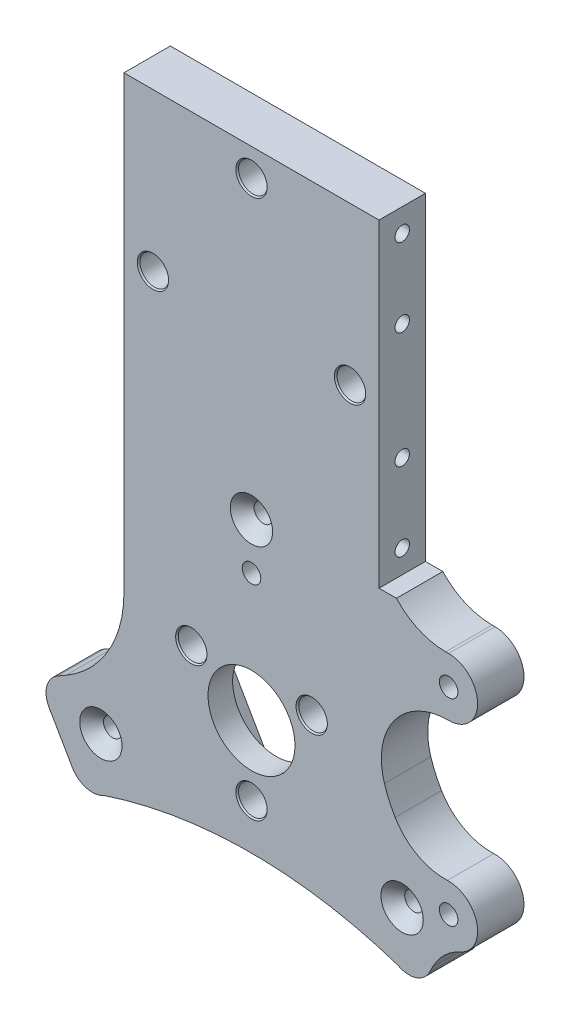
from build123d import *

# Parameters (mm, degrees)
BOSS_EXTRUDE1_DEPTH                             = 8
BOSS_EXTRUDE2_START                             = 3.75
SKETCH1_3_R                                     = 7.5
BOSS_EXTRUDE2_DEPTH                             = 4.25
SKETCH15_W                                      = 44
SKETCH15_H                                      = 8
BOSS_EXTRUDE3_DEPTH                             = 36
SKETCH22_W                                      = 5
SKETCH22_H                                      = 10
CUT_EXTRUDE1_DEPTH                              = 10
CSK_FOR_M3_FLAT_HEAD_MACHINE_SCREW1_D           = 3.2
CSK_FOR_M3_FLAT_HEAD_MACHINE_SCREW1_CSINK_D     = 7.3
CSK_FOR_M3_FLAT_HEAD_MACHINE_SCREW1_CSINK_ANGLE = 90
CBORE_FOR_M3_SBHCS2_AT_2_COUNT                  = 2
CBORE_FOR_M3_SBHCS2_AT_2_PITCH                  = 34
CBORE_FOR_M3_SBHCS2_AT_3_COUNT                  = 2
CBORE_FOR_M3_SBHCS2_AT_3_PITCH                  = 48.083261121
CBORE_FOR_M3_SBHCS2_AT_4_COUNT                  = 2
CBORE_FOR_M3_SBHCS2_AT_4_PITCH                  = 34
CSK_FOR_M4_FLAT_HEAD_MACHINE_SCREW1_D           = 5
CSK_FOR_M4_FLAT_HEAD_MACHINE_SCREW1_CSINK_D     = 5.4
CSK_FOR_M4_FLAT_HEAD_MACHINE_SCREW1_CSINK_ANGLE = 75
FILLET1_R                                       = 10
TAP_DRILL_FOR_M3X0_5_TAP4_AT_2_COUNT            = 2
TAP_DRILL_FOR_M3X0_5_TAP4_AT_2_PITCH            = 13.5
TAP_DRILL_FOR_M3X0_5_TAP4_AT_3_COUNT            = 2
TAP_DRILL_FOR_M3X0_5_TAP4_AT_3_PITCH            = 47
TAP_DRILL_FOR_M3X0_5_TAP4_AT_4_COUNT            = 2
TAP_DRILL_FOR_M3X0_5_TAP4_AT_4_PITCH            = 33.5
CUT_EXTRUDE2_DEPTH                              = 1
CSK_FOR_M4_FLAT_HEAD_MACHINE_SCREW2_D           = 5
CSK_FOR_M4_FLAT_HEAD_MACHINE_SCREW2_CSINK_D     = 5.4
CSK_FOR_M4_FLAT_HEAD_MACHINE_SCREW2_CSINK_ANGLE = 75


with BuildPart() as part:
    # Sketch1 → Boss-Extrude1 (new body)
    with BuildSketch(Plane.XY):
        with BuildLine():
            Line((-34.908965344, -15.535898385), (-30.908965344, -22.464101615))
            ThreePointArc((-30.908965344, -22.464101615), (-28.480139909, -24.32780492), (-25.444863729, -23.92820323))
            ThreePointArc((-25.444863729, -23.92820323), (-0.099802976, -19.807237854), (25.245257776, -23.92820323))
            ThreePointArc((25.245257776, -23.92820323), (28.370669268, -24.230246054), (30.751194283, -22.182679812))
            Line((30.751194283, -22.182679812), (33.327975751, -16.943702652))
            ThreePointArc((33.327975751, -16.943702652), (38.763582033, -10.469765614), (30.583408175, -8.338467401))
            ThreePointArc((30.583408175, -8.338467401), (25.897362485, -3.779012816), (22.93219159, 2.048114425))
            ThreePointArc((22.93219159, 2.048114425), (24.617574432, 12.308222281), (33.890916455, 17.010929616))
            Line((33.890916455, 17.010929616), (34, 17.010929616))
            ThreePointArc((34, 17.010929616), (39.000000252, 22.010929868), (34, 27.01093012))
            Line((34, 27.01093012), (33.494477634, 27.01093012))
            ThreePointArc((33.494477634, 27.01093012), (25.366654553, 30.377584673), (22, 38.505407754))
            Line((22, 38.505407754), (22, 49.757346749))
            Line((22, 49.757346749), (-22, 49.757346749))
            Line((-22, 49.757346749), (-22, 8.082903769))
            ThreePointArc((-22, 8.082903769), (-24.679491924, -1.917096231), (-32, -9.237604307))
            Line((-32, -9.237604307), (-33.444863729, -10.07179677))
            ThreePointArc((-33.444863729, -10.07179677), (-35.308567034, -12.500622204), (-34.908965344, -15.535898385))
        make_face()
        with BuildLine():
            Line((-10.386277084, 10.495620221), (10.386277084, 10.495620221))
            ThreePointArc((10.386277084, 10.495620221), (14.284072501, 8.245422859), (14.284581393, 3.744734354))
            Line((14.284581393, 3.744734354), (3.903550031, -14.242001198))
            ThreePointArc((3.903550031, -14.242001198), (3.3459e-05, -16.496109207), (-3.90351658, -14.242059155))
            Line((-3.90351658, -14.242059155), (-14.284726037, 3.744368131))
            ThreePointArc((-14.284726037, 3.744368131), (-14.284267239, 8.245291146), (-10.386277084, 10.495620221))
        make_face(mode=Mode.SUBTRACT)
    extrude(amount=BOSS_EXTRUDE1_DEPTH)

    # Sketch1<3> → Boss-Extrude2 (add)
    with BuildSketch(Plane.XY.offset(BOSS_EXTRUDE2_START)):
        with BuildLine():
            ThreePointArc((14.284581393, 3.744734354), (14.284072501, 8.245422859), (10.386277084, 10.495620221))
            Line((10.386277084, 10.495620221), (-10.386277084, 10.495620221))
            ThreePointArc((-10.386277084, 10.495620221), (-14.284267239, 8.245291146), (-14.284726037, 3.744368131))
            Line((-14.284726037, 3.744368131), (-12.092701093, -0.053522416))
            Line((-12.092701093, -0.053522416), (-3.90351658, -14.242059155))
            ThreePointArc((-3.90351658, -14.242059155), (3.3459e-05, -16.496109207), (3.903550031, -14.242001198))
            Line((3.903550031, -14.242001198), (14.284581393, 3.744734354))
        make_face()
        Circle(SKETCH1_3_R, mode=Mode.SUBTRACT)
    extrude(amount=BOSS_EXTRUDE2_DEPTH)

    # Sketch15 → Boss-Extrude3 (add)
    with BuildSketch(Plane(origin=(0, 49.757346749, 0), x_dir=(1, 0, 0), z_dir=(0, 1, 0))):
        with Locations((0, -4)):
            Rectangle(SKETCH15_W, SKETCH15_H)
    extrude(amount=BOSS_EXTRUDE3_DEPTH)

    # Sketch4 → Cut-Revolve1 (revolve, cut)
    with BuildSketch(Plane(origin=(0, 0, 0), x_dir=(-1, 0, 0), z_dir=(0, 0, -1))):
        with BuildLine():
            Line((0, 26), (0, 34))
            ThreePointArc((0, 34), (4, 30), (0, 26))
        make_face()
    revolve(axis=Axis((0, 26, 0), (0, 1, 0)), mode=Mode.SUBTRACT)

    # Sketch22 → Cut-Extrude1 (cut)
    with BuildSketch(Plane.XY.offset(8)):
        with Locations((24.5, 35.757346749)):
            Rectangle(SKETCH22_W, SKETCH22_H)
    extrude(amount=-CUT_EXTRUDE1_DEPTH, mode=Mode.SUBTRACT)

    # Sketch5 → Cut-Revolve2 (revolve, cut)
    with BuildSketch(Plane(origin=(0, 0, 0), x_dir=(-1, 0, 0), z_dir=(0, 0, -1))):
        with BuildLine():
            Line((-22.516660498, -13), (-29.444863729, -17))
            ThreePointArc((-29.444863729, -17), (-27.980762114, -11.535898385), (-22.516660498, -13))
        make_face()
    revolve(axis=Axis((22.516660498, -13, 0), (0.8660254037844364, -0.5000000000000041, 0)), mode=Mode.SUBTRACT)

    # Sketch6 → Cut-Revolve3 (revolve, cut)
    with BuildSketch(Plane(origin=(0, 0, 0), x_dir=(-1, 0, 0), z_dir=(0, 0, -1))):
        with BuildLine():
            Line((22.516660498, -13), (29.444863729, -17))
            ThreePointArc((29.444863729, -17), (23.980762114, -18.464101615), (22.516660498, -13))
        make_face()
    revolve(axis=Axis((-22.516660498, -13, 0), (-0.8660254037844433, -0.49999999999999206, 0)), mode=Mode.SUBTRACT)

    # CSK for M3 Flat Head Machine Screw1 (through all)
    with Locations(Plane.XY.offset(8)):
        with Locations((0, 30), (25.980762114, -15), (-25.980762114, -15)):
            CounterSinkHole(CSK_FOR_M3_FLAT_HEAD_MACHINE_SCREW1_D / 2, CSK_FOR_M3_FLAT_HEAD_MACHINE_SCREW1_CSINK_D / 2, counter_sink_angle=CSK_FOR_M3_FLAT_HEAD_MACHINE_SCREW1_CSINK_ANGLE)

    # Sketch12 → CBORE for M3 SBHCS2 (revolve, cut)
    with BuildSketch(Plane(origin=(34, 22.010929787, 0), x_dir=(0, 1, 0), z_dir=(1, 0, 0))):
        Polygon((0, 0), (0, 8), (1.6, 8), (1.6, 3), (3.35, 3), (3.35, 0.025), (3.375, 0), align=None)
    cbore_for_m3_sbhcs2 = revolve(axis=Axis((34, 22.010929787, -6.35), (0, 0, 1)), mode=Mode.SUBTRACT)

    # CBORE for M3 SBHCS2 at 2: CBORE for M3 SBHCS2 ×2
    with Locations(*[(-i * CBORE_FOR_M3_SBHCS2_AT_2_PITCH, 0, 0) for i in range(1, CBORE_FOR_M3_SBHCS2_AT_2_COUNT)]):
        add(cbore_for_m3_sbhcs2, mode=Mode.SUBTRACT)

    # CBORE for M3 SBHCS2 at 3: CBORE for M3 SBHCS2 ×2
    with Locations(*[Vector(-0.7071067811865438, -0.7071067811865512, 0) * (i * CBORE_FOR_M3_SBHCS2_AT_3_PITCH) for i in range(1, CBORE_FOR_M3_SBHCS2_AT_3_COUNT)]):
        add(cbore_for_m3_sbhcs2, mode=Mode.SUBTRACT)

    # CBORE for M3 SBHCS2 at 4: CBORE for M3 SBHCS2 ×2
    with Locations(*[(0, -i * CBORE_FOR_M3_SBHCS2_AT_4_PITCH, 0) for i in range(1, CBORE_FOR_M3_SBHCS2_AT_4_COUNT)]):
        add(cbore_for_m3_sbhcs2, mode=Mode.SUBTRACT)

    # CSK for M4 Flat Head Machine Screw1 (through all)
    with Locations(Plane.XY.offset(8)):
        with Locations((-10.386277084, 5.994432277), (10.386277084, 5.994637855), (0, -11.989070132)):
            CounterSinkHole(CSK_FOR_M4_FLAT_HEAD_MACHINE_SCREW1_D / 2, CSK_FOR_M4_FLAT_HEAD_MACHINE_SCREW1_CSINK_D / 2, counter_sink_angle=CSK_FOR_M4_FLAT_HEAD_MACHINE_SCREW1_CSINK_ANGLE)

    # Fillet1
    fillet1_edges = [part.edges().sort_by_distance(p)[0] for p in [
        (30.583408175, -8.338467401, 4),
        (33.327975751, -16.943702652, 4),
    ]]
    fillet(fillet1_edges, radius=FILLET1_R)

    # Sketch26 → Tap Drill for M3x0.5 Tap4 (revolve, cut)
    with BuildSketch(Plane(origin=(22, 81.757346749, 4), x_dir=(0, 0, -1), z_dir=(0, 1, 0))):
        Polygon((0, 0), (0, 10.751075774), (1.25, 10), (1.25, 0), align=None)
    tap_drill_for_m3x0_5_tap4 = revolve(axis=Axis((28.35, 81.757346749, 4), (-1, 0, 0)), mode=Mode.SUBTRACT)

    # Tap Drill for M3x0.5 Tap4 at 2: Tap Drill for M3x0.5 Tap4 ×2
    with Locations(*[(0, -i * TAP_DRILL_FOR_M3X0_5_TAP4_AT_2_PITCH, 0) for i in range(1, TAP_DRILL_FOR_M3X0_5_TAP4_AT_2_COUNT)]):
        add(tap_drill_for_m3x0_5_tap4, mode=Mode.SUBTRACT)

    # Tap Drill for M3x0.5 Tap4 at 3: Tap Drill for M3x0.5 Tap4 ×2
    with Locations(*[(0, -i * TAP_DRILL_FOR_M3X0_5_TAP4_AT_3_PITCH, 0) for i in range(1, TAP_DRILL_FOR_M3X0_5_TAP4_AT_3_COUNT)]):
        add(tap_drill_for_m3x0_5_tap4, mode=Mode.SUBTRACT)

    # Tap Drill for M3x0.5 Tap4 at 4: Tap Drill for M3x0.5 Tap4 ×2
    with Locations(*[(0, -i * TAP_DRILL_FOR_M3X0_5_TAP4_AT_4_PITCH, 0) for i in range(1, TAP_DRILL_FOR_M3X0_5_TAP4_AT_4_COUNT)]):
        add(tap_drill_for_m3x0_5_tap4, mode=Mode.SUBTRACT)

    # Mirror1: Tap Drill for M3x0.5 Tap4 across plane
    add(tap_drill_for_m3x0_5_tap4.mirror(Plane(origin=(0, 0, 0), x_dir=(0, 0, 1), z_dir=(1, 0, 0))), mode=Mode.SUBTRACT)

    # Mirror1 copy 1 sketch → Mirror1 copy 1 (revolve, cut)
    with BuildSketch(Plane(origin=(-22, 68.257346749, 4), x_dir=(0, 0, -1), z_dir=(0, 1, 0))):
        Polygon((0, 0), (0, -10.751075774), (1.25, -10), (1.25, 0), align=None)
    revolve(axis=Axis((-28.35, 68.257346749, 4), (-1, 0, 0)), mode=Mode.SUBTRACT)

    # Mirror1 copy 2 sketch → Mirror1 copy 2 (revolve, cut)
    with BuildSketch(Plane(origin=(-22, 34.757346749, 4), x_dir=(0, 0, -1), z_dir=(0, 1, 0))):
        Polygon((0, 0), (0, -10.751075774), (1.25, -10), (1.25, 0), align=None)
    revolve(axis=Axis((-28.35, 34.757346749, 4), (-1, 0, 0)), mode=Mode.SUBTRACT)

    # Mirror1 copy 3 sketch → Mirror1 copy 3 (revolve, cut)
    with BuildSketch(Plane(origin=(-22, 48.257346749, 4), x_dir=(0, 0, -1), z_dir=(0, 1, 0))):
        Polygon((0, 0), (0, -10.751075774), (1.25, -10), (1.25, 0), align=None)
    revolve(axis=Axis((-28.35, 48.257346749, 4), (-1, 0, 0)), mode=Mode.SUBTRACT)

    # Sketch27 → Cut-Extrude2 (cut)
    # profile 1 of 6: a face of its own
    with BuildSketch(Plane(origin=(0, 0, 0), x_dir=(-1, 0, 0), z_dir=(0, 0, -1))):
        Polygon((-19.567307692, 75.779891834), (-18.221153846, 75.779891834), (-18.221153846, 72.89527645), (-15.625, 72.89527645), (-15.625, 75.779891834), (-14.278846154, 75.779891834), (-14.278846154, 68.279891834), (-15.625, 68.279891834), (-15.625, 71.549122604), (-18.221153846, 71.549122604), (-18.221153846, 68.279891834), (-19.567307692, 68.279891834), align=None)
    # profile 2 of 6: a face of its own
    with BuildSketch(Plane(origin=(0, 0, 0), x_dir=(-1, 0, 0), z_dir=(0, 0, -1))):
        Polygon((-12.548076923, 75.779891834), (-8.509615385, 75.779891834), (-8.509615385, 74.433737988), (-11.201923077, 74.433737988), (-11.201923077, 72.991430296), (-8.509615385, 72.991430296), (-8.509615385, 71.64527645), (-11.201923077, 71.64527645), (-11.201923077, 69.62604568), (-8.509615385, 69.62604568), (-8.509615385, 68.279891834), (-12.548076923, 68.279891834), align=None)
    # profile 3 of 6: a face of its own
    with BuildSketch(Plane(origin=(0, 0, 0), x_dir=(-1, 0, 0), z_dir=(0, 0, -1))):
        Polygon((-6.570012019, 75.779891834), (-5.172776442, 75.779891834), (-3.461538462, 70.548521642), (-1.73828125, 75.779891834), (-0.354567308, 75.779891834), (0.913461538, 68.279891834), (-0.44921875, 68.279891834), (-1.25, 73.016971161), (-2.809495192, 68.279891834), (-4.122596154, 68.279891834), (-5.673076923, 73.016971161), (-6.472355769, 68.279891834), (-7.836538462, 68.279891834), align=None)
    # profile 4 of 6: a face of its own
    with BuildSketch(Plane(origin=(0, 0, 0), x_dir=(-1, 0, 0), z_dir=(0, 0, -1))):
        Polygon((2.163461538, 75.779891834), (6.201923077, 75.779891834), (6.201923077, 74.433737988), (3.509615385, 74.433737988), (3.509615385, 72.991430296), (6.201923077, 72.991430296), (6.201923077, 71.64527645), (3.509615385, 71.64527645), (3.509615385, 69.62604568), (6.201923077, 69.62604568), (6.201923077, 68.279891834), (2.163461538, 68.279891834), align=None)
    # profile 5 of 6: a face of its own
    with BuildSketch(Plane(origin=(0, 0, 0), x_dir=(-1, 0, 0), z_dir=(0, 0, -1))):
        with BuildLine():
            Line((7.548076923, 75.779891834), (9.116586538, 75.779891834))
            add(Edge.make_bspline(
                [(9.116586538, 75.779891834), (9.220264547, 75.779523837), (9.419666561, 75.778816074), (9.707193374, 75.767649453), (9.971326293, 75.752110184), (10.212456392, 75.728396846), (10.430480509, 75.696955827), (10.625617157, 75.659892069), (10.797860632, 75.617649969), (10.94866357, 75.565012981), (11.084755764, 75.505639256), (11.211612609, 75.437417757), (11.332032756, 75.361108152), (11.445211326, 75.274702529), (11.552131869, 75.179755304), (11.652996094, 75.076170904), (11.746378699, 74.963070974), (11.831701453, 74.841170163), (11.909466275, 74.712933306), (11.978194068, 74.578184332), (12.034083624, 74.436829532), (12.083468037, 74.290911789), (12.119038031, 74.138345179), (12.14377644, 73.980614965), (12.161888936, 73.81716592), (12.162930318, 73.706125896), (12.163461538, 73.64948318)],
                knots=[0, 0, 0, 0, 1.749336639, 3.364467119, 4.854658419, 6.213483162, 7.451590619, 8.570285859, 9.5643256, 10.440900261, 11.26203566, 12.067320669, 12.869050712, 13.665104639, 14.467235401, 15.27997916, 16.102287765, 16.939272006, 17.78853747, 18.631303466, 19.488103222, 20.351255419, 21.228522269, 22.127379805, 23.044756219, 24, 24, 24, 24], degree=3))
            add(Edge.make_bspline(
                [(12.163461538, 73.64948318), (12.16208162, 73.590361198), (12.15937585, 73.474433765), (12.144801103, 73.304145822), (12.118163044, 73.141226229), (12.077815829, 72.986151994), (12.031441945, 72.836993039), (11.969776575, 72.696501439), (11.900181111, 72.562633948), (11.817524611, 72.437284171), (11.726813141, 72.31766784), (11.621317609, 72.2083679), (11.507872506, 72.103509893), (11.380100669, 72.00966177), (11.243634399, 71.920477859), (11.095762255, 71.839653484), (10.937449302, 71.765156908), (10.826147455, 71.723612472), (10.769230769, 71.702367796)],
                knots=[0, 0, 0, 0, 1.099860209, 2.156625411, 3.176576793, 4.16617041, 5.135385252, 6.078461593, 7.016046972, 7.938469504, 8.868247731, 9.803980173, 10.76021508, 11.73834243, 12.748633912, 13.790971185, 14.870363756, 16, 16, 16, 16], degree=3))
            Line((10.769230769, 71.702367796), (12.5, 68.279891834))
            Line((12.5, 68.279891834), (11.003605769, 68.279891834))
            Line((11.003605769, 68.279891834), (9.350961538, 71.549122604))
            Line((9.350961538, 71.549122604), (8.894230769, 71.549122604))
            Line((8.894230769, 71.549122604), (8.894230769, 68.279891834))
            Line((8.894230769, 68.279891834), (7.548076923, 68.279891834))
            Line((7.548076923, 68.279891834), (7.548076923, 75.779891834))
        make_face()
        with BuildLine():
            Line((8.894230769, 72.89527645), (9.418569712, 72.89527645))
            add(Edge.make_bspline(
                [(9.418569712, 72.89527645), (9.482674506, 72.895998441), (9.605421412, 72.897380899), (9.781947586, 72.903793313), (9.942275451, 72.919244062), (10.087093509, 72.938765506), (10.217130471, 72.961305833), (10.331226454, 72.993607489), (10.431139503, 73.028219531), (10.515685645, 73.071233321), (10.587919925, 73.12014933), (10.650289603, 73.175719131), (10.701878269, 73.240034101), (10.744338373, 73.311346435), (10.777367717, 73.390286874), (10.801476609, 73.47598883), (10.814949913, 73.569428559), (10.816500063, 73.633914696), (10.817307692, 73.667512027)],
                knots=[0, 0, 0, 0, 1.688639943, 3.233382647, 4.650958383, 5.928841754, 7.082724185, 8.122798841, 9.049171256, 9.863274652, 10.613301712, 11.341792392, 12.054588806, 12.776240173, 13.521029143, 14.301969904, 15.115324896, 16, 16, 16, 16], degree=3))
            add(Edge.make_bspline(
                [(10.817307692, 73.667512027), (10.815780795, 73.707260122), (10.812781489, 73.785337889), (10.783019051, 73.897742497), (10.73564368, 74.001780652), (10.670705021, 74.096982284), (10.588923224, 74.180442607), (10.495072158, 74.254013546), (10.387126293, 74.31218794), (10.287176545, 74.35055915), (10.196245636, 74.373517041), (10.11418336, 74.390625059), (10.01915475, 74.402750002), (9.911088065, 74.415610662), (9.790258771, 74.42395015), (9.656008275, 74.430036313), (9.508722145, 74.432526462), (9.406049723, 74.433322518), (9.352463942, 74.433737988)],
                knots=[0, 0, 0, 0, 1.020303359, 2.004196876, 2.966617323, 3.9489082, 4.950758222, 5.960522915, 7.003732012, 8.091992268, 8.70421221, 9.413913587, 10.24622431, 11.166358409, 12.212345909, 13.359657661, 14.621978493, 16, 16, 16, 16], degree=3))
            Line((9.352463942, 74.433737988), (8.894230769, 74.433737988))
            Line((8.894230769, 74.433737988), (8.894230769, 72.89527645))
        make_face(mode=Mode.SUBTRACT)
    # profile 6 of 6: a face of its own
    with BuildSketch(Plane(origin=(0, 0, 0), x_dir=(-1, 0, 0), z_dir=(0, 0, -1))):
        Polygon((15.914963942, 75.779891834), (17.163461538, 75.779891834), (20.192307692, 68.279891834), (18.754507212, 68.279891834), (18.171574519, 69.818353373), (14.903846154, 69.818353373), (14.320913462, 68.279891834), (12.884615385, 68.279891834), align=None)
        Polygon((16.538461538, 73.768173084), (15.414663462, 71.164507219), (17.662259615, 71.164507219), align=None, mode=Mode.SUBTRACT)
    extrude(amount=-CUT_EXTRUDE2_DEPTH, mode=Mode.SUBTRACT)

    # CSK for M4 Flat Head Machine Screw2 (through all)
    with Locations(Plane.XY.offset(8)):
        with Locations((17, 58.6053253), (-17, 58.6053253), (0, 81.006313958)):
            CounterSinkHole(CSK_FOR_M4_FLAT_HEAD_MACHINE_SCREW2_D / 2, CSK_FOR_M4_FLAT_HEAD_MACHINE_SCREW2_CSINK_D / 2, counter_sink_angle=CSK_FOR_M4_FLAT_HEAD_MACHINE_SCREW2_CSINK_ANGLE)


solid = part.part
